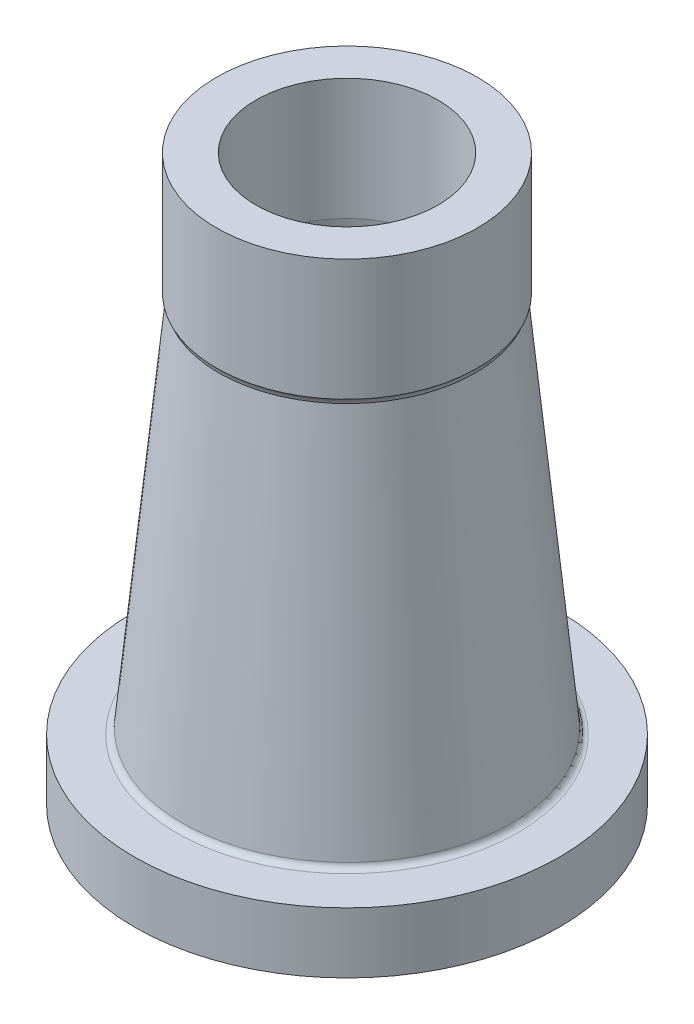
from build123d import *


with BuildPart() as part:
    # Sketch1 → Revolve1 (revolve)
    with BuildSketch(Plane.XY, mode=Mode.PRIVATE) as revolve1_sk:
        with BuildLine():
            Line((30, 186), (43, 186))
            Line((43, 186), (43, 146))
            ThreePointArc((43, 146), (42.529020072, 145.151277561), (42.230898499, 144.22754849))
            Line((42.230898499, 144.22754849), (54.216310346, 21.805127486))
            ThreePointArc((54.216310346, 21.805127486), (54.863243552, 20.518489786), (56.206793881, 20))
            Line((56.206793881, 20), (70, 20))
            Line((70, 20), (70, 0))
            Line((70, 0), (50, 0))
            Line((50, 0), (49.883019474, 1.194872514))
            ThreePointArc((49.883019474, 1.194872514), (49.236086268, 2.481510214), (47.892535939, 3))
            Line((47.892535939, 3), (44, 3))
            Line((44, 3), (30, 146))
            Line((30, 146), (30, 186))
        make_face()
    revolve(revolve1_sk.sketch.rotate(Axis((0, 0, 0), (0, 1, 0)), 90), axis=Axis((0, 0, 0), (0, 1, 0)))


solid = part.part
